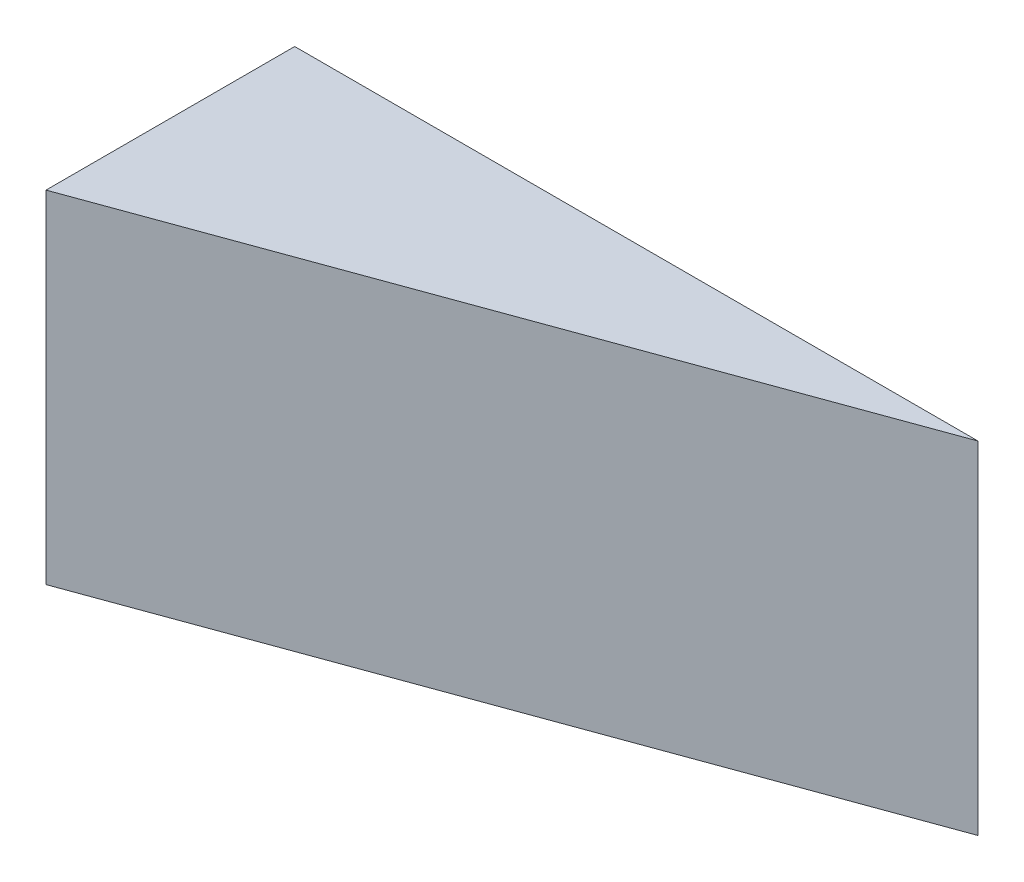
from build123d import *

# Parameters (mm, degrees)
BOSS_EXTRUDE1_DEPTH = 20


with BuildPart() as part:
    # Sketch1 → Boss-Extrude1 (new body)
    with BuildSketch(Plane(origin=(0, 0, 0), x_dir=(1, 0, 0), z_dir=(0, 1, 0))):
        Polygon((0, 0), (40, 0), (0, -14.558809371), align=None)
    extrude(amount=BOSS_EXTRUDE1_DEPTH)


solid = part.part
